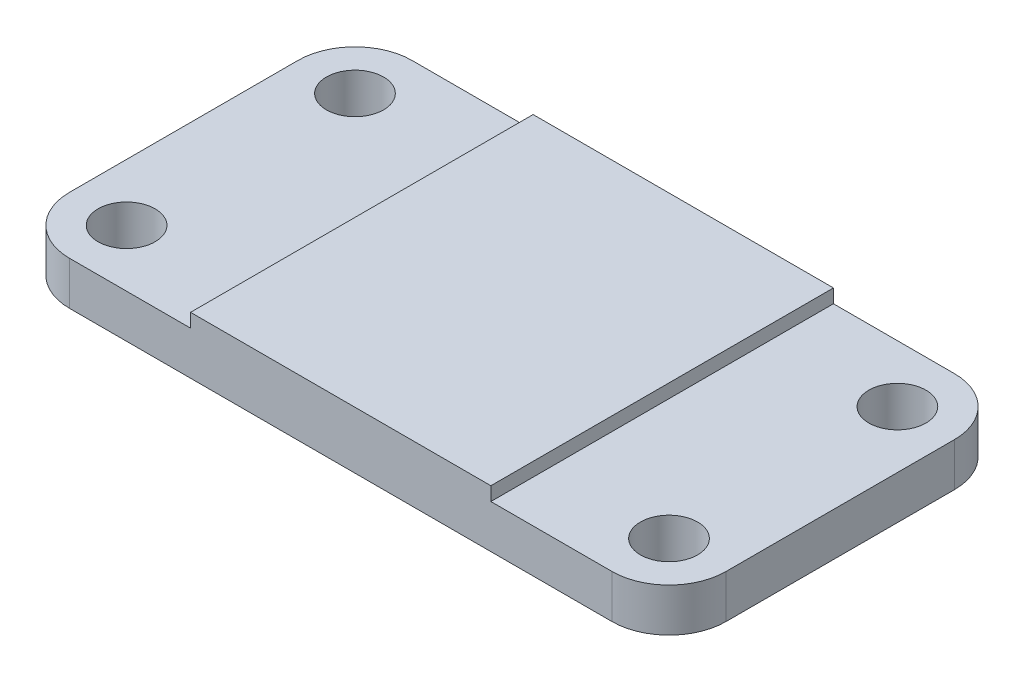
from build123d import *

# Parameters (mm, degrees)
SKETCH1_W                  = 146.05
SKETCH1_H                  = 76.2
BOSS_EXTRUDE1_DEPTH        = 9.652
SKETCH2_W                  = 66.802
SKETCH2_H                  = 76.2
BOSS_EXTRUDE2_DEPTH        = 3.048
FILLET1_R                  = 12.7
F_3_8_0_5_DIAMETER_HOLE1_D = 12.7


with BuildPart() as part:
    # Sketch1 → Boss-Extrude1 (new body)
    with BuildSketch(Plane(origin=(0, 0, 0), x_dir=(1, 0, 0), z_dir=(0, 1, 0))):
        Rectangle(SKETCH1_W, SKETCH1_H)
    extrude(amount=BOSS_EXTRUDE1_DEPTH)

    # Sketch2 → Boss-Extrude2 (add)
    with BuildSketch(Plane(origin=(0, 9.652, 0), x_dir=(1, 0, 0), z_dir=(0, 1, 0))):
        Rectangle(SKETCH2_W, SKETCH2_H)
    extrude(amount=BOSS_EXTRUDE2_DEPTH)

    # Fillet1
    fillet1_edges = [part.edges().sort_by_distance(p)[0] for p in [
        (73.025, 4.826, 38.1),
        (-73.025, 4.826, 38.1),
        (-73.025, 4.826, -38.1),
        (73.025, 4.826, -38.1),
    ]]
    fillet(fillet1_edges, radius=FILLET1_R)

    # 3/8 (0.5) Diameter Hole1 (through all)
    with Locations(Plane(origin=(0, 9.652, 0), x_dir=(1, 0, 0), z_dir=(0, 1, 0))):
        with Locations((-60.325, 25.4), (-60.325, -25.4), (60.325, -25.4), (60.325, 25.4)):
            Hole(F_3_8_0_5_DIAMETER_HOLE1_D / 2)


solid = part.part
